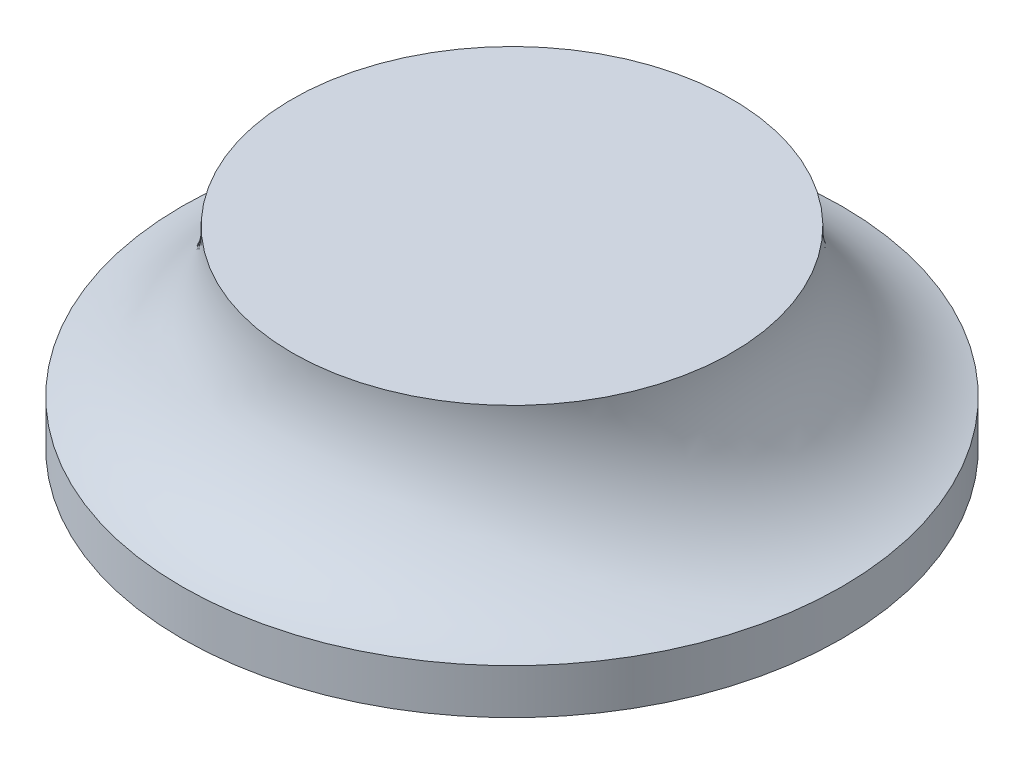
from build123d import *


with BuildPart() as part:
    # Sketch1 → Revolve1 (revolve)
    with BuildSketch(Plane.XY, mode=Mode.PRIVATE) as revolve1_sk:
        with BuildLine():
            Line((-0.15, 0.087650602), (-0.15, -0.087650602))
            Line((-0.15, -0.087650602), (0.15, -0.087650602))
            Line((0.15, -0.087650602), (0.15, -0.046695245))
            ThreePointArc((0.15, -0.046695245), (0.076503925, 0.002988433), (0.05, 0.087650602))
            Line((0.05, 0.087650602), (-0.15, 0.087650602))
        make_face()
    revolve(revolve1_sk.sketch.rotate(Axis((-0.15, 0.087650602, 0), (0, -1, 0)), 90), axis=Axis((-0.15, 0.087650602, 0), (0, -1, 0)))


solid = part.part
